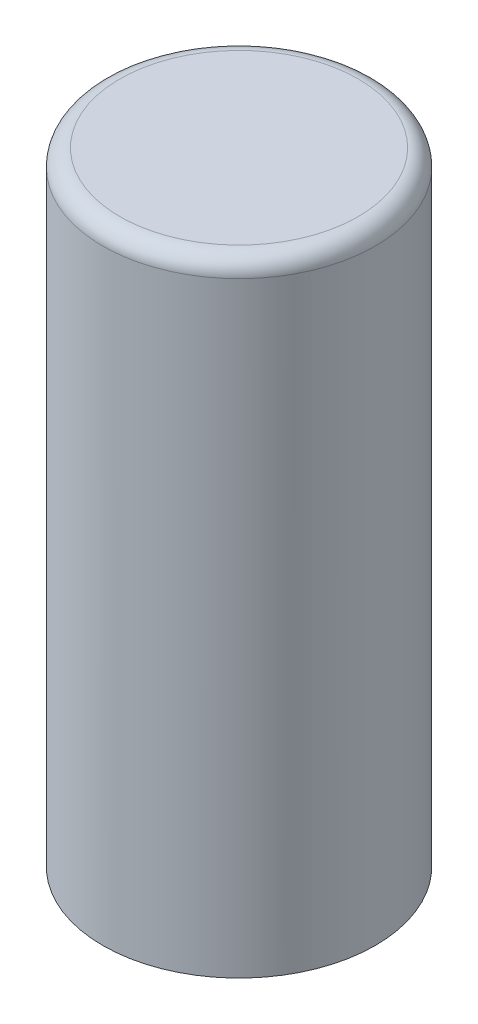
from build123d import *

# Parameters (mm, degrees)
SKETCH1_R           = 12.7
BOSS_EXTRUDE1_DEPTH = 58.039
FILLET1_R           = 1.5875
SHELL1_T            = -0.7874


with BuildPart() as part:
    # Sketch1 → Boss-Extrude1 (new body)
    with BuildSketch(Plane(origin=(0, 0, 0), x_dir=(1, 0, 0), z_dir=(0, 1, 0))):
        with Locations(Location((0, 0, 0), (0, 0, 90))):
            Circle(SKETCH1_R)
    extrude(amount=BOSS_EXTRUDE1_DEPTH)

    # Fillet1
    fillet1_edges = [part.edges().sort_by_distance(p)[0] for p in [
        (0, 58.039, 12.7),
    ]]
    fillet(fillet1_edges, radius=FILLET1_R)

    # Shell1
    shell1_openings = [part.faces().sort_by_distance(p)[0] for p in [
        (0, 0, 0),
    ]]
    offset(amount=SHELL1_T, openings=shell1_openings, kind=Kind.INTERSECTION)


solid = part.part
